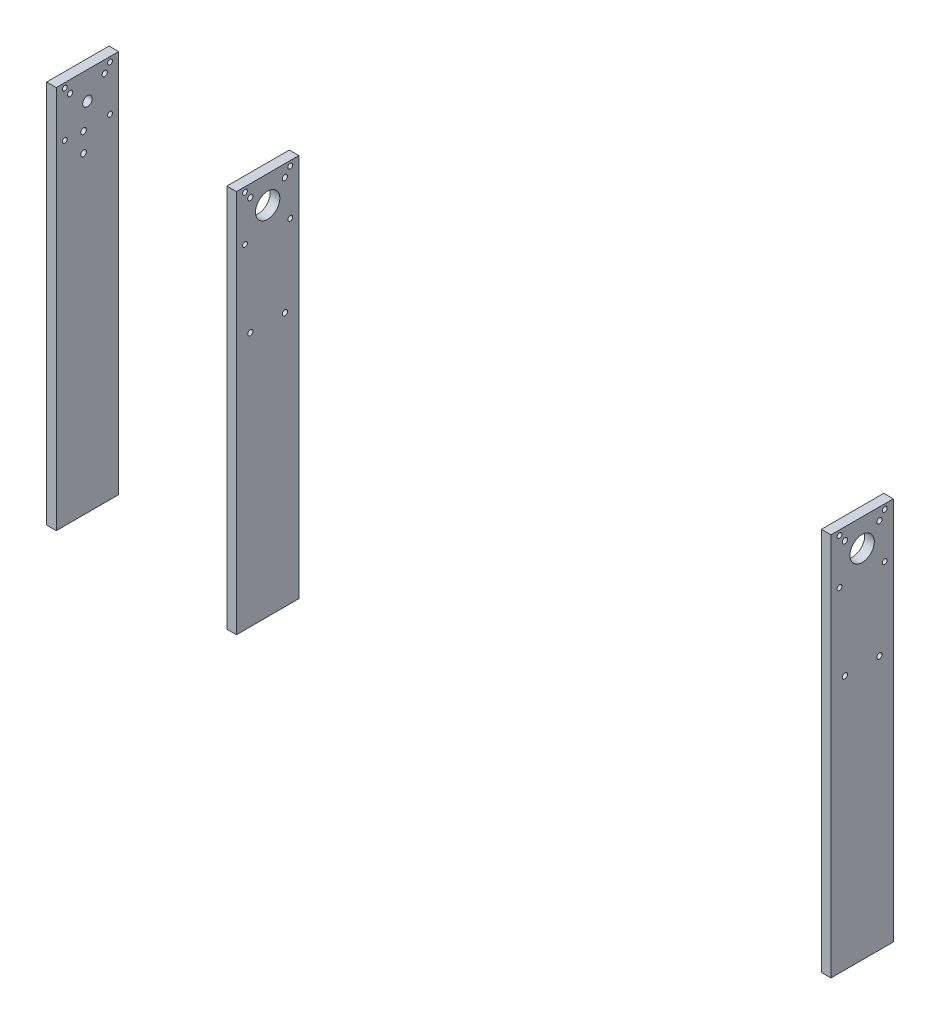
from build123d import *

# Parameters (mm, degrees)
SKETCH1_W            = 65
SKETCH1_H            = 400
SKETCH1_R            = 2.54
SKETCH1_R_2          = 12.7
SKETCH1_R_3          = 2.75
BOSS_EXTRUDE1_DEPTH  = 10
SKETCH15_W           = 65
SKETCH15_H           = 400
SKETCH15_R           = 2.54
SKETCH15_R_2         = 3
SKETCH15_R_3         = 5
SKETCH15_R_4         = 2.75
BOSS_EXTRUDE11_DEPTH = 10
SKETCH16_W           = 65
SKETCH16_H           = 400
SKETCH16_R           = 2.54
SKETCH16_R_2         = 12.7
SKETCH16_R_3         = 2.75
BOSS_EXTRUDE12_DEPTH = 10


with BuildPart() as part:
    # Sketch1 → Boss-Extrude1 (new body)
    with BuildSketch(Plane(origin=(0, 0, 0), x_dir=(0, 0, -1), z_dir=(1, 0, 0))):
        with Locations((0, -171.425)):
            Rectangle(SKETCH1_W, SKETCH1_H)
        with Locations((-23.5712, 23.5712)):
            Circle(SKETCH1_R, mode=Mode.SUBTRACT)
        with Locations((23.5712, 23.5712)):
            Circle(SKETCH1_R, mode=Mode.SUBTRACT)
        with Locations((23.5712, -23.5712)):
            Circle(SKETCH1_R, mode=Mode.SUBTRACT)
        with Locations((-23.5712, -23.5712)):
            Circle(SKETCH1_R, mode=Mode.SUBTRACT)
        Circle(SKETCH1_R_2, mode=Mode.SUBTRACT)
        with Locations((18, 16)):
            Circle(SKETCH1_R_3, mode=Mode.SUBTRACT)
        with Locations((-18, 16)):
            Circle(SKETCH1_R_3, mode=Mode.SUBTRACT)
        with Locations((18, -106)):
            Circle(SKETCH1_R_3, mode=Mode.SUBTRACT)
        with Locations((-18, -106)):
            Circle(SKETCH1_R_3, mode=Mode.SUBTRACT)
    extrude(amount=-BOSS_EXTRUDE1_DEPTH)


with BuildPart() as body_2:
    # Sketch15 → Boss-Extrude11 (new body)
    with BuildSketch(Plane.ZY.offset(187.8)):
        with Locations((0, -171.425)):
            Rectangle(SKETCH15_W, SKETCH15_H)
        with Locations((-23.5712, 23.5712)):
            Circle(SKETCH15_R, mode=Mode.SUBTRACT)
        with Locations((23.5712, 23.5712)):
            Circle(SKETCH15_R, mode=Mode.SUBTRACT)
        with Locations((-23.5712, -23.5712)):
            Circle(SKETCH15_R, mode=Mode.SUBTRACT)
        with Locations((23.5712, -23.5712)):
            Circle(SKETCH15_R, mode=Mode.SUBTRACT)
        with Locations((4, -25)):
            Circle(SKETCH15_R_2, mode=Mode.SUBTRACT)
        with Locations((4, -45)):
            Circle(SKETCH15_R_2, mode=Mode.SUBTRACT)
        Circle(SKETCH15_R_3, mode=Mode.SUBTRACT)
        with Locations((18, 16)):
            Circle(SKETCH15_R_4, mode=Mode.SUBTRACT)
        with Locations((-18, 16)):
            Circle(SKETCH15_R_4, mode=Mode.SUBTRACT)
    extrude(amount=BOSS_EXTRUDE11_DEPTH)


with BuildPart() as body_3:
    # Sketch16 → Boss-Extrude12 (new body)
    with BuildSketch(Plane(origin=(609.6, 0, 0), x_dir=(0, 0, -1), z_dir=(1, 0, 0))):
        with Locations((0, -171.425)):
            Rectangle(SKETCH16_W, SKETCH16_H)
        with Locations((-23.5712, 23.5712)):
            Circle(SKETCH16_R, mode=Mode.SUBTRACT)
        with Locations((23.5712, 23.5712)):
            Circle(SKETCH16_R, mode=Mode.SUBTRACT)
        with Locations((23.5712, -23.5712)):
            Circle(SKETCH16_R, mode=Mode.SUBTRACT)
        with Locations((-23.5712, -23.5712)):
            Circle(SKETCH16_R, mode=Mode.SUBTRACT)
        Circle(SKETCH16_R_2, mode=Mode.SUBTRACT)
        with Locations((18, 16)):
            Circle(SKETCH16_R_3, mode=Mode.SUBTRACT)
        with Locations((-18, 16)):
            Circle(SKETCH16_R_3, mode=Mode.SUBTRACT)
        with Locations((18, -106)):
            Circle(SKETCH16_R_3, mode=Mode.SUBTRACT)
        with Locations((-18, -106)):
            Circle(SKETCH16_R_3, mode=Mode.SUBTRACT)
    extrude(amount=BOSS_EXTRUDE12_DEPTH)


solid = Compound([part.part, body_2.part, body_3.part])
